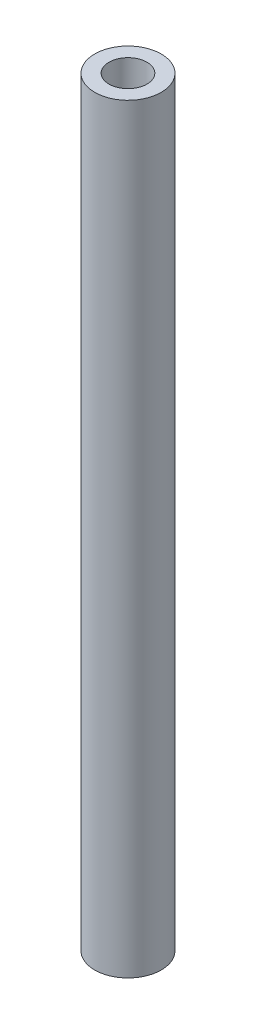
from build123d import *

# Parameters (mm, degrees)
SKETCH1_R           = 1.75
SKETCH1_R_2         = 1
BOSS_EXTRUDE1_DEPTH = 40


with BuildPart() as part:
    # Sketch1 → Boss-Extrude1 (new body)
    with BuildSketch(Plane(origin=(0, 0, 0), x_dir=(1, 0, 0), z_dir=(0, 1, 0))):
        with Locations(Location((0, 0, 0), (0, 0, 270))):
            Circle(SKETCH1_R)
        with Locations(Location((0, 0, 0), (0, 0, 270))):
            Circle(SKETCH1_R_2, mode=Mode.SUBTRACT)
    extrude(amount=BOSS_EXTRUDE1_DEPTH)


solid = part.part
